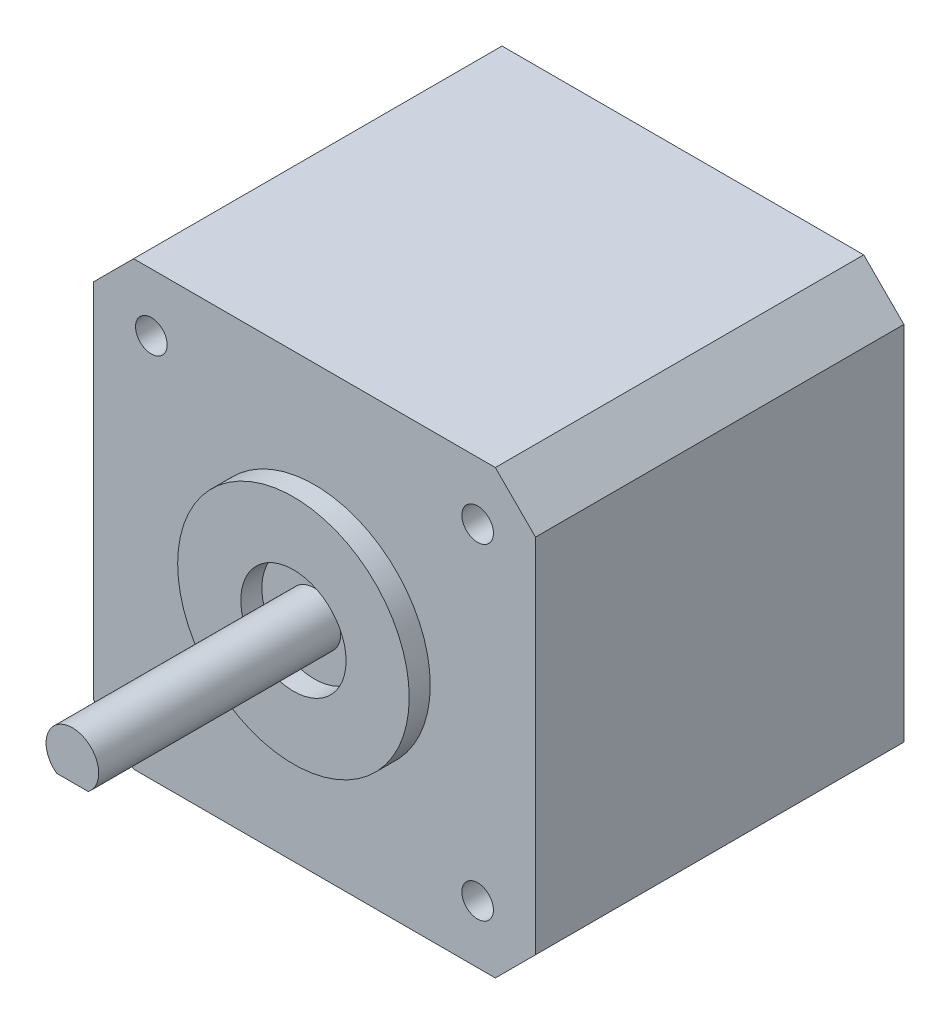
from build123d import *

# Parameters (mm, degrees)
EXTRUDE_1_DEPTH     = 35
SKETCH_2_R          = 11
SKETCH_2_R_2        = 5
EXTRUDE_2_DEPTH     = 2
SKETCH_3_R          = 2.5
EXTRUDE_3_DEPTH     = 23
CUT_EXTRUDE_START   = -18
CUT_EXTRUDE_1_DEPTH = 18
SKETCH_5_R          = 1.5
CUT_EXTRUDE_2_DEPTH = 5


with BuildPart() as part:
    # 草图1 → 凸台-拉伸1 (new body)
    with BuildSketch(Plane.XY):
        Polygon((-17.183766184, 21), (17.183766184, 21), (21, 17.183766184), (21, -17.183766184), (17.183766184, -21), (-17.183766184, -21), (-21, -17.183766184), (-21, 17.183766184), align=None)
    extrude(amount=EXTRUDE_1_DEPTH)

    # 草图2 → 凸台-拉伸2 (add)
    with BuildSketch(Plane.XY.offset(35)):
        with Locations(Location((0, 0, 0), (0, 0, 180))):
            Circle(SKETCH_2_R)
        Circle(SKETCH_2_R_2, mode=Mode.SUBTRACT)
    extrude(amount=EXTRUDE_2_DEPTH)

    # 草图3 → 凸台-拉伸3 (add)
    with BuildSketch(Plane.XY.offset(35)):
        with Locations(Location((0, 0, 0), (0, 0, 180))):
            Circle(SKETCH_3_R)
    extrude(amount=EXTRUDE_3_DEPTH)

    # 草图4 → 切除-拉伸1 (cut)
    with BuildSketch(Plane.XY.offset(58).offset(CUT_EXTRUDE_START)):
        with BuildLine():
            Line((1.5, -2), (-1.5, -2))
            ThreePointArc((-1.5, -2), (0, -2.5), (1.5, -2))
        make_face()
    extrude(amount=CUT_EXTRUDE_1_DEPTH, mode=Mode.SUBTRACT)

    # 草图5 → 切除-拉伸2 (cut)
    with BuildSketch(Plane.XY.offset(35)):
        with Locations((-15.5, 15.5)):
            Circle(SKETCH_5_R)
        with Locations((15.5, 15.5)):
            Circle(SKETCH_5_R)
        with Locations((15.5, -15.5)):
            Circle(SKETCH_5_R)
        with Locations((-15.5, -15.5)):
            Circle(SKETCH_5_R)
    extrude(amount=-CUT_EXTRUDE_2_DEPTH, mode=Mode.SUBTRACT)


solid = part.part
